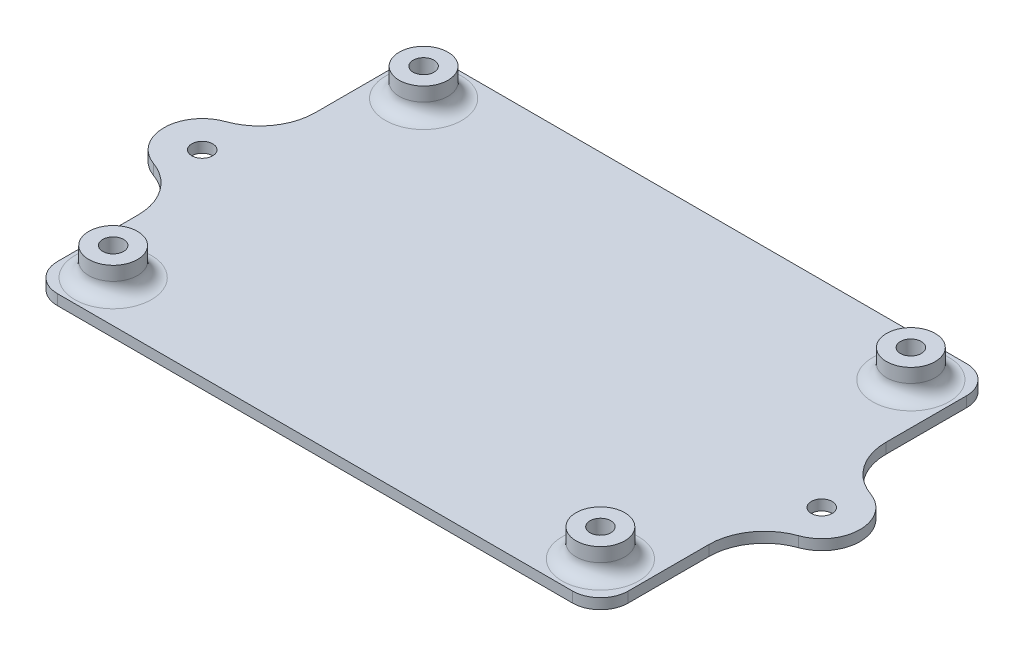
from build123d import *

# Parameters (mm, degrees)
SKETCH1_W           = 82
SKETCH1_H           = 56.6
SKETCH1_R           = 3.5
SKETCH1_R_2         = 1.5
BOSS_EXTRUDE1_DEPTH = 1.5
SKETCH1_3_R         = 3.5
SKETCH1_3_R_2       = 1.5
BOSS_EXTRUDE2_DEPTH = 5.5
FILLET1_R           = 2
FILLET2_R           = 4


with BuildPart() as part:
    # Sketch1 → Boss-Extrude1 (new body)
    # profile 1 of 11: a face of its own
    with BuildSketch(Plane(origin=(0, 0, 0), x_dir=(1, 0, 0), z_dir=(0, 1, 0))):
        Rectangle(SKETCH1_W, SKETCH1_H)
        with Locations((-35, -22.3)):
            Circle(SKETCH1_R, mode=Mode.SUBTRACT)
        with Locations((35, -22.3)):
            Circle(SKETCH1_R, mode=Mode.SUBTRACT)
        with Locations((35, 22.3)):
            Circle(SKETCH1_R, mode=Mode.SUBTRACT)
        with Locations((-35, 22.3)):
            Circle(SKETCH1_R, mode=Mode.SUBTRACT)
    # profile 2 of 11: a face of its own
    with BuildSketch(Plane(origin=(0, 0, 0), x_dir=(1, 0, 0), z_dir=(0, 1, 0))):
        with BuildLine():
            ThreePointArc((-46.333333333, -5.185449729), (-42.468027353, -8.109119908), (-41, -12.727922061))
            Line((-41, -12.727922061), (-41, 12.727922061))
            ThreePointArc((-41, 12.727922061), (-42.468027353, 8.109119908), (-46.333333333, 5.185449729))
            ThreePointArc((-46.333333333, 5.185449729), (-50, 0), (-46.333333333, -5.185449729))
        make_face()
        with Locations(Location((-44.5, 0, 0), (0, 0, 270))):
            Circle(SKETCH1_R_2, mode=Mode.SUBTRACT)
    # profile 3 of 11: a face of its own
    with BuildSketch(Plane(origin=(0, 0, 0), x_dir=(1, 0, 0), z_dir=(0, 1, 0))):
        with BuildLine():
            Line((41, 12.727922061), (41, -12.727922061))
            ThreePointArc((41, -12.727922061), (42.468027353, -8.109119908), (46.333333333, -5.185449729))
            ThreePointArc((46.333333333, -5.185449729), (50, 0), (46.333333333, 5.185449729))
            ThreePointArc((46.333333333, 5.185449729), (42.468027353, 8.109119908), (41, 12.727922061))
        make_face()
        with Locations(Location((44.5, 0, 0), (0, 0, 270))):
            Circle(SKETCH1_R_2, mode=Mode.SUBTRACT)
    # profile 4 of 11: a face of its own
    with BuildSketch(Plane(origin=(0, 0, 0), x_dir=(1, 0, 0), z_dir=(0, 1, 0))):
        with Locations((-35, -22.3)):
            Circle(SKETCH1_R)
        with Locations((-35, -22.3)):
            Circle(SKETCH1_R_2, mode=Mode.SUBTRACT)
    # profile 5 of 11: a face of its own
    with BuildSketch(Plane(origin=(0, 0, 0), x_dir=(1, 0, 0), z_dir=(0, 1, 0))):
        with Locations((-35, -22.3)):
            Circle(SKETCH1_R_2)
    # profile 6 of 11: a face of its own
    with BuildSketch(Plane(origin=(0, 0, 0), x_dir=(1, 0, 0), z_dir=(0, 1, 0))):
        with Locations((35, -22.3)):
            Circle(SKETCH1_R)
        with Locations((35, -22.3)):
            Circle(SKETCH1_R_2, mode=Mode.SUBTRACT)
    # profile 7 of 11: a face of its own
    with BuildSketch(Plane(origin=(0, 0, 0), x_dir=(1, 0, 0), z_dir=(0, 1, 0))):
        with Locations((35, -22.3)):
            Circle(SKETCH1_R_2)
    # profile 8 of 11: a face of its own
    with BuildSketch(Plane(origin=(0, 0, 0), x_dir=(1, 0, 0), z_dir=(0, 1, 0))):
        with Locations((35, 22.3)):
            Circle(SKETCH1_R)
        with Locations((35, 22.3)):
            Circle(SKETCH1_R_2, mode=Mode.SUBTRACT)
    # profile 9 of 11: a face of its own
    with BuildSketch(Plane(origin=(0, 0, 0), x_dir=(1, 0, 0), z_dir=(0, 1, 0))):
        with Locations((35, 22.3)):
            Circle(SKETCH1_R_2)
    # profile 10 of 11: a face of its own
    with BuildSketch(Plane(origin=(0, 0, 0), x_dir=(1, 0, 0), z_dir=(0, 1, 0))):
        with Locations((-35, 22.3)):
            Circle(SKETCH1_R)
        with Locations((-35, 22.3)):
            Circle(SKETCH1_R_2, mode=Mode.SUBTRACT)
    # profile 11 of 11: a face of its own
    with BuildSketch(Plane(origin=(0, 0, 0), x_dir=(1, 0, 0), z_dir=(0, 1, 0))):
        with Locations((-35, 22.3)):
            Circle(SKETCH1_R_2)
    extrude(amount=BOSS_EXTRUDE1_DEPTH)

    # Sketch1<3> → Boss-Extrude2 (add)
    # profile 1 of 4: a face of its own
    with BuildSketch(Plane(origin=(0, 0, 0), x_dir=(1, 0, 0), z_dir=(0, 1, 0))):
        with Locations(Location((-35, 22.3, 0), (0, 0, 270))):
            Circle(SKETCH1_3_R)
        with Locations(Location((-35, 22.3, 0), (0, 0, 270))):
            Circle(SKETCH1_3_R_2, mode=Mode.SUBTRACT)
    # profile 2 of 4: a face of its own
    with BuildSketch(Plane(origin=(0, 0, 0), x_dir=(1, 0, 0), z_dir=(0, 1, 0))):
        with Locations(Location((35, 22.3, 0), (0, 0, 270))):
            Circle(SKETCH1_3_R)
        with Locations(Location((35, 22.3, 0), (0, 0, 270))):
            Circle(SKETCH1_3_R_2, mode=Mode.SUBTRACT)
    # profile 3 of 4: a face of its own
    with BuildSketch(Plane(origin=(0, 0, 0), x_dir=(1, 0, 0), z_dir=(0, 1, 0))):
        with Locations(Location((35, -22.3, 0), (0, 0, 270))):
            Circle(SKETCH1_3_R)
        with Locations(Location((35, -22.3, 0), (0, 0, 270))):
            Circle(SKETCH1_3_R_2, mode=Mode.SUBTRACT)
    # profile 4 of 4: a face of its own
    with BuildSketch(Plane(origin=(0, 0, 0), x_dir=(1, 0, 0), z_dir=(0, 1, 0))):
        with Locations(Location((-35, -22.3, 0), (0, 0, 270))):
            Circle(SKETCH1_3_R)
        with Locations(Location((-35, -22.3, 0), (0, 0, 270))):
            Circle(SKETCH1_3_R_2, mode=Mode.SUBTRACT)
    extrude(amount=BOSS_EXTRUDE2_DEPTH)

    # Fillet1
    fillet1_edges = [part.edges().sort_by_distance(p)[0] for p in [
        (-35, 1.5, -25.8),
        (35, 1.5, -25.8),
        (35, 1.5, 18.8),
        (-35, 1.5, 18.8),
    ]]
    fillet(fillet1_edges, radius=FILLET1_R)

    # Fillet2
    fillet2_edges = [part.edges().sort_by_distance(p)[0] for p in [
        (-41, 0.75, 28.3),
        (-41, 0.75, -28.3),
        (41, 0.75, -28.3),
        (41, 0.75, 28.3),
    ]]
    fillet(fillet2_edges, radius=FILLET2_R)


solid = part.part
